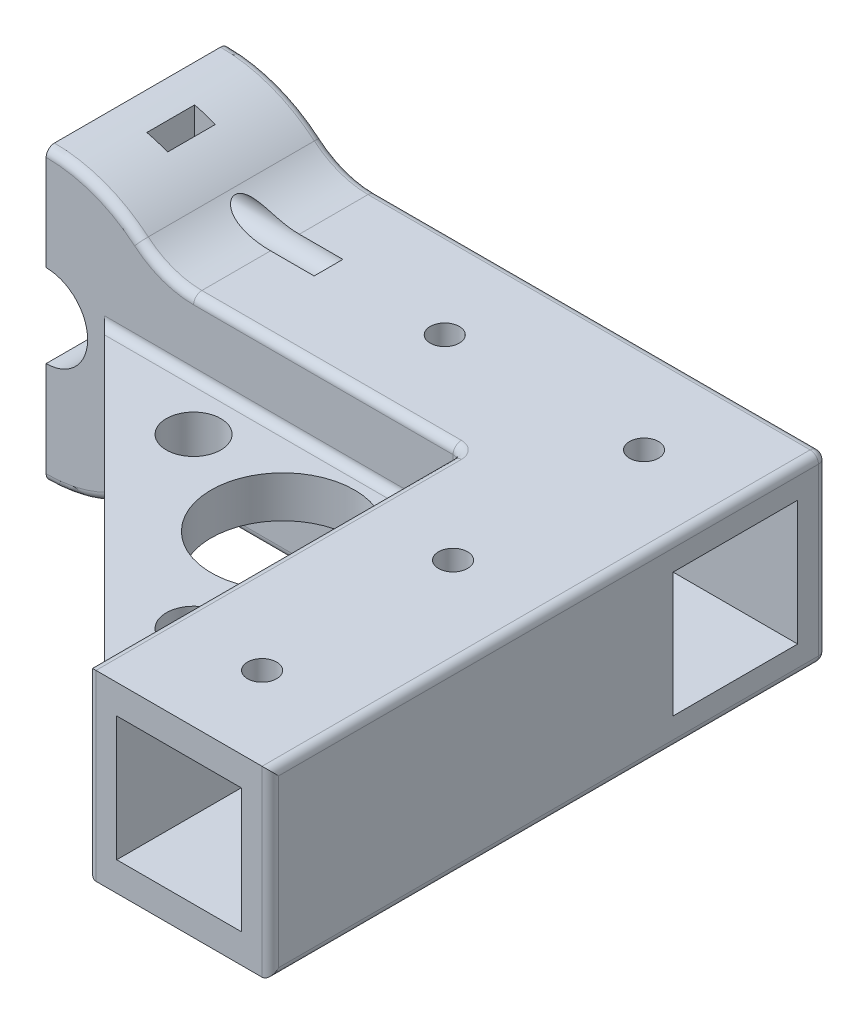
from build123d import *

# Parameters (mm, degrees)
BOSS_EXTRUDE1_DEPTH      = 22
SKETCH2_W                = 22
SKETCH2_H                = 22
BOSS_EXTRUDE2_DEPTH      = 45
SKETCH3_W                = 15
SKETCH3_H                = 15
CUT_EXTRUDE1_DEPTH       = 43
SKETCH4_W                = 15
SKETCH4_H                = 15
CUT_EXTRUDE2_DEPTH       = 45
BOSS_EXTRUDE3_DEPTH      = 2.5
BOSS_EXTRUDE3_DEPTH_BACK = 2.5
FILLET1_R                = 10
SKETCH5_R                = 1.75
CUT_EXTRUDE3_DEPTH       = 23
CUT_EXTRUDE4_START       = -3.5
SKETCH7_W                = 2.5
SKETCH7_H                = 5.75
CUT_EXTRUDE4_DEPTH       = 13.5
CUT_EXTRUDE5_START       = -22
SKETCH8_R                = 1.75
CUT_EXTRUDE5_DEPTH       = 22
SKETCH9_W                = 4.563380282
SKETCH9_H                = 3.718309859
CUT_EXTRUDE6_DEPTH       = 1.5
SKETCH10_R               = 8.636857144
SKETCH10_R_2             = 3.280749897
CUT_EXTRUDE7_DEPTH       = 5
FILLET2_R                = 1


with BuildPart() as part:
    # Sketch1 → Boss-Extrude1 (new body)
    with BuildSketch(Plane.XY):
        with BuildLine():
            Line((5.170578839, 4.123318258), (63.55992125, 4.123318258))
            Line((63.55992125, 4.123318258), (63.55992125, -17.876681742))
            Line((63.55992125, -17.876681742), (5.170578839, -17.876681742))
            ThreePointArc((5.170578839, -17.876681742), (-0.898527186, -22.66829344), (-8.44007875, -24.376681742))
            Line((-8.44007875, -24.376681742), (-8.44007875, -14.35565445))
            Line((-8.44007875, -14.35565445), (-8.44007875, -11.876681742))
            ThreePointArc((-8.44007875, -11.876681742), (-3.44007875, -6.876681742), (-8.44007875, -1.876681742))
            Line((-8.44007875, -1.876681742), (-8.44007875, 7.64434555))
            Line((-8.44007875, 7.64434555), (-8.44007875, 10.623318258))
            ThreePointArc((-8.44007875, 10.623318258), (-0.898527186, 8.914929955), (5.170578839, 4.123318258))
        make_face()
    extrude(amount=BOSS_EXTRUDE1_DEPTH)

    # Sketch2 → Boss-Extrude2 (add)
    with BuildSketch(Plane.XY.offset(22)):
        with Locations((52.55992125, -6.876681742)):
            Rectangle(SKETCH2_W, SKETCH2_H)
    extrude(amount=BOSS_EXTRUDE2_DEPTH)

    # Sketch3 → Cut-Extrude1 (cut)
    with BuildSketch(Plane.XY.offset(67)):
        with Locations((52.55992125, -6.876681742)):
            Rectangle(SKETCH3_W, SKETCH3_H)
    extrude(amount=-CUT_EXTRUDE1_DEPTH, mode=Mode.SUBTRACT)

    # Sketch4 → Cut-Extrude2 (cut)
    with BuildSketch(Plane(origin=(63.55992125, 0, 0), x_dir=(0, 0, -1), z_dir=(1, 0, 0))):
        with Locations((-11, -6.876681742)):
            Rectangle(SKETCH4_W, SKETCH4_H)
    extrude(amount=-CUT_EXTRUDE2_DEPTH, mode=Mode.SUBTRACT)

    # Sketch6 → Boss-Extrude3 (add, two sides: drawn at the far end of the back side and taken through both)
    with BuildSketch(Plane(origin=(0, -6.876681742, 0), x_dir=(1, 0, 0), z_dir=(0, 1, 0)).offset(-BOSS_EXTRUDE3_DEPTH_BACK)):
        Polygon((-1.44007875, -22), (41.55992125, -65), (41.55992125, -22), align=None)
    extrude(amount=BOSS_EXTRUDE3_DEPTH + BOSS_EXTRUDE3_DEPTH_BACK)

    # Fillet1
    fillet1_edges = [part.edges().sort_by_distance(p)[0] for p in [
        (5.170578839, -17.876681742, 11),
        (5.170578839, 4.123318258, 11),
    ]]
    fillet(fillet1_edges, radius=FILLET1_R)

    # Sketch5 → Cut-Extrude3 (cut)
    with BuildSketch(Plane.ZY.offset(8.44007875)):
        with Locations((11, 4.373318258)):
            Circle(SKETCH5_R)
        with Locations((11, -18.126681742)):
            Circle(SKETCH5_R)
    extrude(amount=-CUT_EXTRUDE3_DEPTH, mode=Mode.SUBTRACT)

    # Sketch7 → Cut-Extrude4 (cut)
    with BuildSketch(Plane(origin=(0, 4.123318258, 0), x_dir=(1, 0, 0), z_dir=(0, 1, 0)).offset(CUT_EXTRUDE4_START)):
        with Locations((-3.19007875, -11)):
            Rectangle(SKETCH7_W, SKETCH7_H)
    cut_extrude4 = extrude(amount=CUT_EXTRUDE4_DEPTH, mode=Mode.SUBTRACT)

    # Mirror1: Cut-Extrude4 across plane
    add(cut_extrude4.mirror(Plane.ZX.offset(-6.876681742)), mode=Mode.SUBTRACT)

    # Sketch8 → Cut-Extrude5 (cut)
    with BuildSketch(Plane.XZ.offset(17.876681742).offset(CUT_EXTRUDE5_START)):
        with Locations((28.55992125, 11)):
            Circle(SKETCH8_R)
        with Locations((52.55992125, 11)):
            Circle(SKETCH8_R)
        with Locations(Location((52.55992125, 34, 0), (0, 0, 270))):
            Circle(SKETCH8_R)
        with Locations(Location((52.55992125, 57, 0), (0, 0, 270))):
            Circle(SKETCH8_R)
    extrude(amount=CUT_EXTRUDE5_DEPTH, mode=Mode.SUBTRACT)

    # Sketch9 → Cut-Extrude6 (cut)
    # profile 1 of 6: a face of its own
    with BuildSketch(Plane(origin=(0, 0, 0), x_dir=(-1, 0, 0), z_dir=(0, 0, -1))):
        Polygon((-53.489498715, -1.045695827), (-52.94020294, -1.853794418), (-52.94020294, -12.876681742), (-54.26854801, -12.876681742), (-54.79935787, -12.118759207), (-54.79935787, -8.989357799), (-59.048477588, -8.989357799), (-59.362738151, -9.472632447), (-59.362738151, -12.068583151), (-59.927878996, -12.876681742), (-60.691083222, -12.876681742), (-61.221893081, -12.124040897), (-61.221893081, -8.822984559), (-55.958688855, -1.045695827), align=None)
        Polygon((-55.248301532, -3.242878925), (-57.691083222, -6.7921747), (-54.79935787, -6.7921747), (-54.79935787, -3.242878925), align=None, mode=Mode.SUBTRACT)
    # profile 2 of 6: a face of its own
    with BuildSketch(Plane(origin=(0, 0, 0), x_dir=(-1, 0, 0), z_dir=(0, 0, -1))):
        Polygon((-50.950590264, -0.961188785), (-50.446188855, -0.876681742), (-49.88104801, -1.695343714), (-49.88104801, -10.679498644), (-45.317667729, -10.679498644), (-45.317667729, -9.506963432), (-44.784217024, -8.746400052), (-44.026294489, -8.746400052), (-43.458512799, -9.557139489), (-43.458512799, -12.876681742), (-51.230519841, -12.876681742), (-51.74020294, -12.116118362), (-51.74020294, -1.639885968), (-51.021893081, -0.998160616), align=None)
    # profile 3 of 6: a face of its own
    with BuildSketch(Plane(origin=(0, 0, 0), x_dir=(-1, 0, 0), z_dir=(0, 0, -1))):
        Polygon((-34.011153644, -2.289533855), (-34.549886039, -3.073864841), (-40.39935787, -3.073864841), (-40.39935787, -6.7921747), (-34.549886039, -6.7921747), (-34.011153644, -7.579146531), (-34.011153644, -8.205026813), (-34.549886039, -8.989357799), (-40.39935787, -8.989357799), (-40.39935787, -12.068583151), (-40.964498715, -12.876681742), (-41.72770294, -12.876681742), (-42.258512799, -12.116118362), (-42.258512799, -1.639885968), (-41.725062095, -0.876681742), (-34.549886039, -0.876681742), (-34.011153644, -1.663653573), align=None)
    # profile 4 of 6: a face of its own
    with BuildSketch(Plane(origin=(0, 0, 0), x_dir=(-1, 0, 0), z_dir=(0, 0, -1))):
        Polygon((-32.26713956, -0.876681742), (-25.036505757, -0.876681742), (-24.495132517, -1.690062024), (-24.495132517, -8.181259207), (-25.033864912, -8.989357799), (-27.085801532, -8.989357799), (-24.495132517, -12.876681742), (-26.64213956, -12.876681742), (-29.209040968, -8.989357799), (-30.917667729, -8.989357799), (-30.917667729, -12.068583151), (-31.482808574, -12.876681742), (-32.246012799, -12.876681742), (-32.776822658, -12.116118362), (-32.776822658, -1.639885968), align=None)
        with Locations((-28.635977588, -4.933019771)):
            Rectangle(SKETCH9_W, SKETCH9_H, mode=Mode.SUBTRACT)
    # profile 5 of 6: a face of its own
    with BuildSketch(Plane(origin=(0, 0, 0), x_dir=(-1, 0, 0), z_dir=(0, 0, -1))):
        Polygon((-23.295132517, -12.087069066), (-23.295132517, -10.848512728), (-23.295132517, -9.506963432), (-22.761681813, -8.746400052), (-22.003759278, -8.746400052), (-21.435977588, -9.557139489), (-21.435977588, -10.679498644), (-16.872597306, -10.679498644), (-16.872597306, -6.961188785), (-22.788090264, -6.961188785), (-23.295132517, -6.2296747), (-23.295132517, -5.500801461), (-22.788090264, -4.764005686), (-16.872597306, -4.764005686), (-16.872597306, -3.073864841), (-22.788090264, -3.073864841), (-23.295132517, -2.342350756), (-23.295132517, -1.613477517), (-22.780167729, -0.876681742), (-15.554815616, -0.876681742), (-15.013442377, -1.690062024), (-15.013442377, -12.876681742), (-15.784569137, -12.876681742), (-22.782808574, -12.876681742), (-23.028407165, -12.137245123), align=None)
    # profile 6 of 6: a face of its own
    with BuildSketch(Plane(origin=(0, 0, 0), x_dir=(-1, 0, 0), z_dir=(0, 0, -1))):
        Polygon((-13.303759278, -0.876681742), (-10.824005757, -0.876681742), (-5.531752236, -8.817702869), (-5.531752236, -12.876681742), (-6.302878996, -12.876681742), (-13.303759278, -12.876681742), (-13.813442377, -12.116118362), (-13.813442377, -1.639885968), align=None)
        Polygon((-11.539674771, -3.073864841), (-11.954287447, -3.073864841), (-11.954287447, -10.679498644), (-7.390907165, -10.679498644), (-7.390907165, -9.575625404), align=None, mode=Mode.SUBTRACT)
    extrude(amount=-CUT_EXTRUDE6_DEPTH, mode=Mode.SUBTRACT)

    # Sketch10 → Cut-Extrude7 (cut)
    with BuildSketch(Plane.XZ.offset(9.376681742)):
        with Locations(Location((30.80992125, 32.75, 0), (0, 0, 270))):
            Circle(SKETCH10_R)
        with Locations(Location((35.55992125, 48.25, 0), (0, 0, 270))):
            Circle(SKETCH10_R_2)
        with Locations(Location((15.30992125, 28, 0), (0, 0, 270))):
            Circle(SKETCH10_R_2)
    extrude(amount=-CUT_EXTRUDE7_DEPTH, mode=Mode.SUBTRACT)

    # Fillet2
    fillet2_edges = [part.edges().sort_by_distance(p)[0] for p in [
        (63.55992125, -6.876681742, 0),
        (-2.424001804, -23.310087299, 0),
        (63.55992125, 4.123318258, 33.5),
        (63.55992125, -17.876681742, 33.5),
        (-2.424001804, -23.310087299, 22),
        (25.437561702, 4.123318258, 22),
        (41.55992125, -0.126681742, 22),
        (41.55992125, 4.123318258, 44.5),
        (41.55992125, -17.876681742, 44.5),
        (63.55992125, -6.876681742, 67),
        (41.55992125, -6.876681742, 67),
        (41.55992125, -13.626681742, 22),
        (20.05992125, -9.376681742, 22),
        (41.55992125, -9.376681742, 43.5),
        (20.05992125, -4.376681742, 22),
        (41.55992125, -4.376681742, 43.5),
        (36.437561702, -17.876681742, 0),
        (25.437561702, -17.876681742, 22),
        (-2.424001804, 9.556723814, 0),
        (-2.424001804, 9.556723814, 22),
        (5.8774439, -18.486164282, 0),
        (5.8774439, -18.486164282, 22),
        (5.8774439, 4.732800797, 0),
        (5.8774439, 4.732800797, 22),
        (36.437561702, 4.123318258, 0),
    ]]
    fillet(fillet2_edges, radius=FILLET2_R)


solid = part.part
